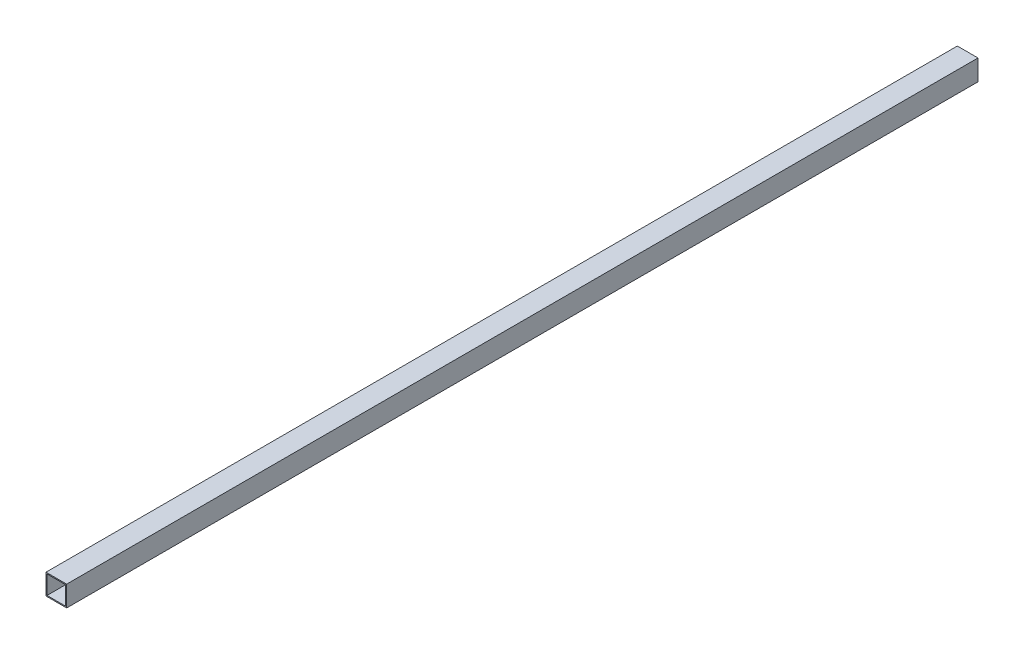
from build123d import *

# Parameters (mm, degrees)
SKETCH1_W           = 31.75
SKETCH1_H           = 31.75
SKETCH1_W_2         = 28.575
SKETCH1_H_2         = 28.575
BOSS_EXTRUDE1_DEPTH = 1400


with BuildPart() as part:
    # Sketch1 → Boss-Extrude1 (new body)
    with BuildSketch(Plane.XY):
        Rectangle(SKETCH1_W, SKETCH1_H)
        Rectangle(SKETCH1_W_2, SKETCH1_H_2, mode=Mode.SUBTRACT)
    extrude(amount=BOSS_EXTRUDE1_DEPTH)


solid = part.part
